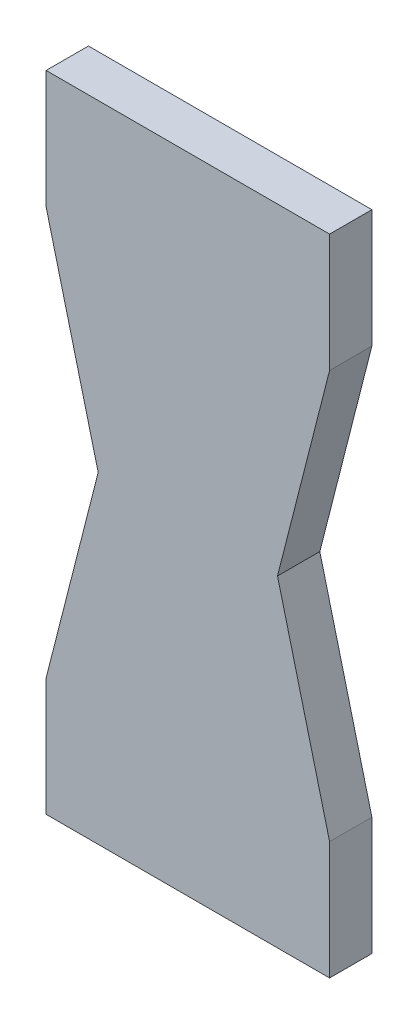
from build123d import *

# Parameters (mm, degrees)
ESTRUSIONE_ESTRUSIONE1_DEPTH = 1.97


with BuildPart() as part:
    # Schizzo1 → Estrusione-Estrusione1 (new body)
    with BuildSketch(Plane.XY):
        Polygon((23.407634403, 39.729835541), (10.207634403, 39.729835541), (10.207634403, 34.229835541), (12.632634403, 24.729835541), (10.207634403, 15.229835541), (10.207634403, 9.729835541), (23.407634403, 9.729835541), (23.407634403, 15.229835541), (20.982634403, 24.729835541), (23.407634403, 34.229835541), align=None)
    extrude(amount=ESTRUSIONE_ESTRUSIONE1_DEPTH)


solid = part.part
